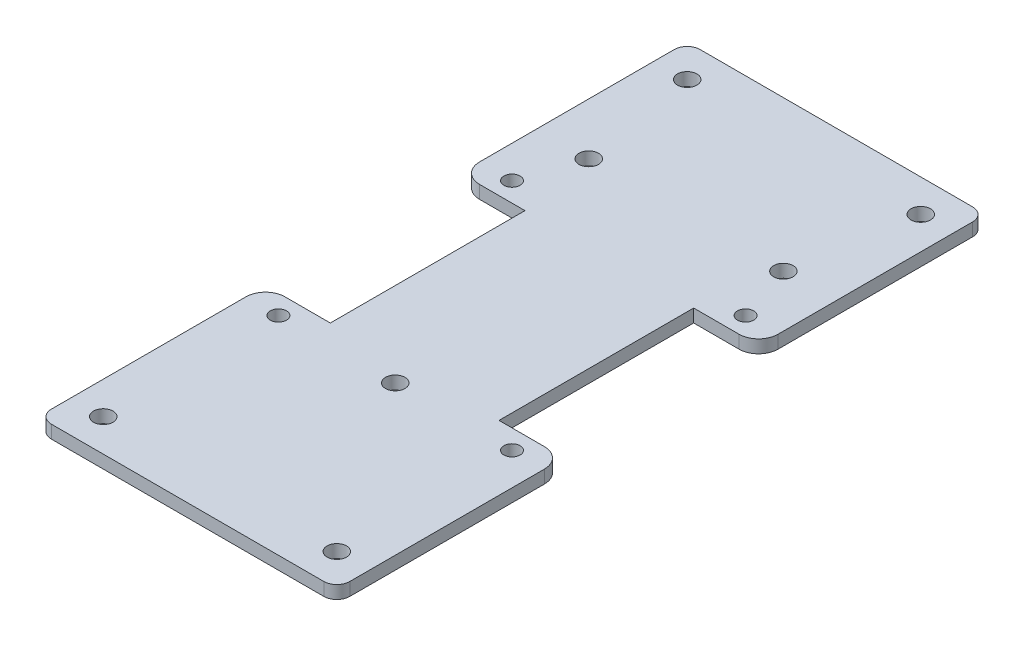
from build123d import *

# Parameters (mm, degrees)
SKETCH_1_W          = 46
SKETCH_1_H          = 100
SKETCH_1_R          = 1.25
SKETCH_1_R_2        = 1.5
EXTRUDE_1_DEPTH     = 2
FILLET_1_R          = 2
SKETCH_2_W          = 10
SKETCH_2_H          = 30
CUT_EXTRUDE_1_DEPTH = 80.429213769
FILLET_2_R          = 3


with BuildPart() as part:
    # 草图1 → 凸台-拉伸1 (new body)
    with BuildSketch(Plane(origin=(0, 0, 0), x_dir=(1, 0, 0), z_dir=(0, 1, 0))):
        with Locations((18, 18)):
            Rectangle(SKETCH_1_W, SKETCH_1_H)
        with Locations(Location((0, 36, 0), (0, 0, 270))):
            Circle(SKETCH_1_R, mode=Mode.SUBTRACT)
        with Locations(Location((36, 36, 0), (0, 0, 270))):
            Circle(SKETCH_1_R, mode=Mode.SUBTRACT)
        with Locations(Location((0, 0, 0), (0, 0, 270))):
            Circle(SKETCH_1_R, mode=Mode.SUBTRACT)
        with Locations(Location((36, 0, 0), (0, 0, 270))):
            Circle(SKETCH_1_R, mode=Mode.SUBTRACT)
        with Locations(Location((0, 63, 0), (0, 0, 270))):
            Circle(SKETCH_1_R_2, mode=Mode.SUBTRACT)
        with Locations(Location((36, 63, 0), (0, 0, 270))):
            Circle(SKETCH_1_R_2, mode=Mode.SUBTRACT)
        with Locations(Location((36, -27, 0), (0, 0, 90))):
            Circle(SKETCH_1_R_2, mode=Mode.SUBTRACT)
        with Locations(Location((0, -27, 0), (0, 0, 90))):
            Circle(SKETCH_1_R_2, mode=Mode.SUBTRACT)
        with Locations(Location((3, 44.83, 0), (0, 0, 270))):
            Circle(SKETCH_1_R_2, mode=Mode.SUBTRACT)
        with Locations(Location((33, 44.83, 0), (0, 0, 270))):
            Circle(SKETCH_1_R_2, mode=Mode.SUBTRACT)
        with Locations(Location((18, 0, 0), (0, 0, 270))):
            Circle(SKETCH_1_R_2, mode=Mode.SUBTRACT)
    extrude(amount=EXTRUDE_1_DEPTH)

    # 圆角1
    fillet_1_edges = [part.edges().sort_by_distance(p)[0] for p in [
        (-5, 1, -68),
        (41, 1, -68),
        (41, 1, 32),
        (-5, 1, 32),
    ]]
    fillet(fillet_1_edges, radius=FILLET_1_R)

    # 草图2 → 切除-拉伸1 (cut, through all)
    with BuildSketch(Plane(origin=(0, 2, 0), x_dir=(1, 0, 0), z_dir=(0, 1, 0))):
        with Locations((0, 18)):
            Rectangle(SKETCH_2_W, SKETCH_2_H)
        with Locations((36, 18)):
            Rectangle(SKETCH_2_W, SKETCH_2_H)
    extrude(amount=-CUT_EXTRUDE_1_DEPTH, mode=Mode.SUBTRACT)

    # 圆角2
    fillet_2_edges = [part.edges().sort_by_distance(p)[0] for p in [
        (-5, 1, -3),
        (-5, 1, -33),
        (41, 1, -33),
        (41, 1, -3),
    ]]
    fillet(fillet_2_edges, radius=FILLET_2_R)


solid = part.part
